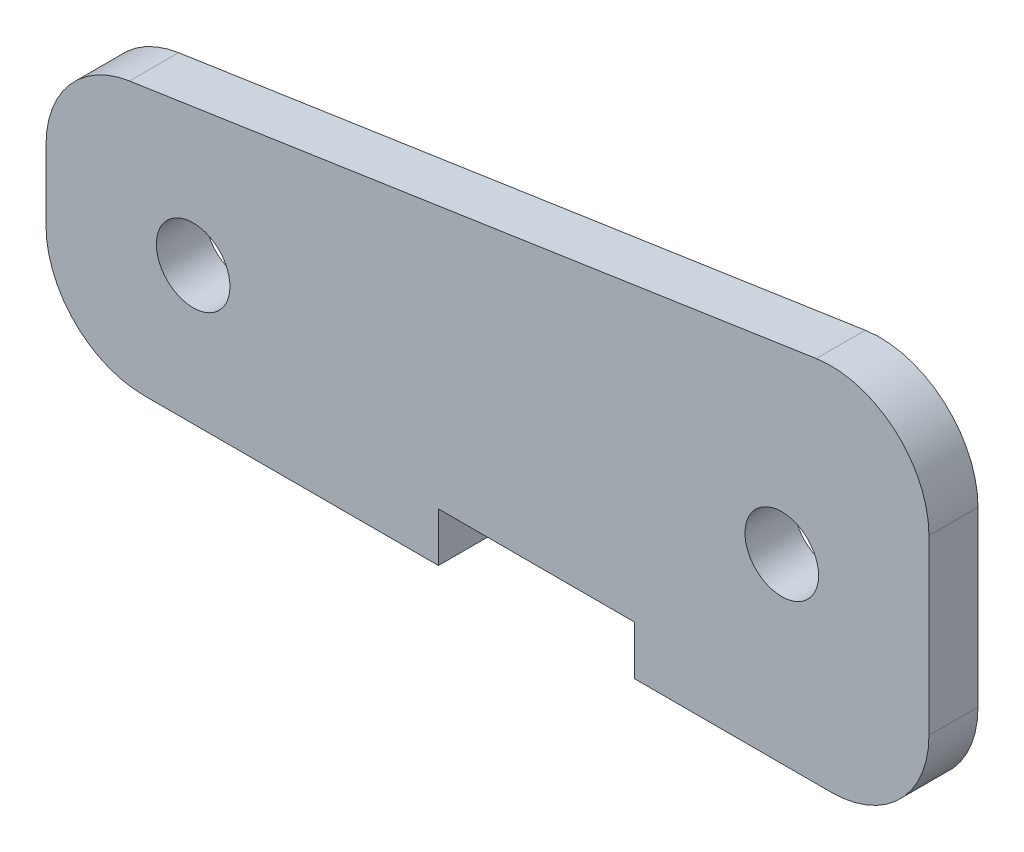
from build123d import *

# Parameters (mm, degrees)
BOSS_EXTRUDE1_DEPTH = 3.175


with BuildPart() as part:
    # Sketch1 → Boss-Extrude1 (new body)
    with BuildSketch(Plane.XY):
        with BuildLine():
            Line((-307.975, 0), (-304.8, 0))
            Line((-304.8, 0), (-304.8, 6.50875))
            ThreePointArc((-304.8, 6.50875), (-307.18125, 8.89), (-304.8, 11.27125))
            Line((-304.8, 11.27125), (-304.8, 17.78))
            Line((-304.8, 17.78), (-308.916961876, 17.162455719))
            ThreePointArc((-308.916961876, 17.162455719), (-312.786650336, 15.026442621), (-314.325, 10.882709878))
            Line((-314.325, 10.882709878), (-314.325, 6.35))
            ThreePointArc((-314.325, 6.35), (-312.465128061, 1.859871939), (-307.975, 0))
        make_face()
        with BuildLine():
            Line((-304.8, 0), (-288.925, 0))
            Line((-288.925, 0), (-288.925, 3.175))
            Line((-288.925, 3.175), (-276.225, 3.175))
            Line((-276.225, 3.175), (-276.225, 0))
            Line((-276.225, 0), (-266.7, 0))
            Line((-266.7, 0), (-266.7, 9.36625))
            ThreePointArc((-266.7, 9.36625), (-269.08125, 11.7475), (-266.7, 14.12875))
            Line((-266.7, 14.12875), (-266.7, 23.495))
            Line((-266.7, 23.495), (-304.8, 17.78))
            Line((-304.8, 17.78), (-304.8, 11.27125))
            ThreePointArc((-304.8, 11.27125), (-303.116201977, 10.573798023), (-302.41875, 8.89))
            ThreePointArc((-302.41875, 8.89), (-303.116201977, 7.206201977), (-304.8, 6.50875))
            Line((-304.8, 6.50875), (-304.8, 0))
        make_face()
        with BuildLine():
            Line((-266.7, 9.36625), (-266.7, 0))
            Line((-266.7, 0), (-263.525, 0))
            ThreePointArc((-263.525, 0), (-259.034871939, 1.859871939), (-257.175, 6.35))
            Line((-257.175, 6.35), (-257.175, 17.550209878))
            ThreePointArc((-257.175, 17.550209878), (-259.381267257, 22.361860214), (-264.466961876, 23.829955719))
            Line((-264.466961876, 23.829955719), (-266.7, 23.495))
            Line((-266.7, 23.495), (-266.7, 14.12875))
            ThreePointArc((-266.7, 14.12875), (-265.016201977, 13.431298023), (-264.31875, 11.7475))
            ThreePointArc((-264.31875, 11.7475), (-265.016201977, 10.063701977), (-266.7, 9.36625))
        make_face()
    extrude(amount=BOSS_EXTRUDE1_DEPTH)


solid = part.part
